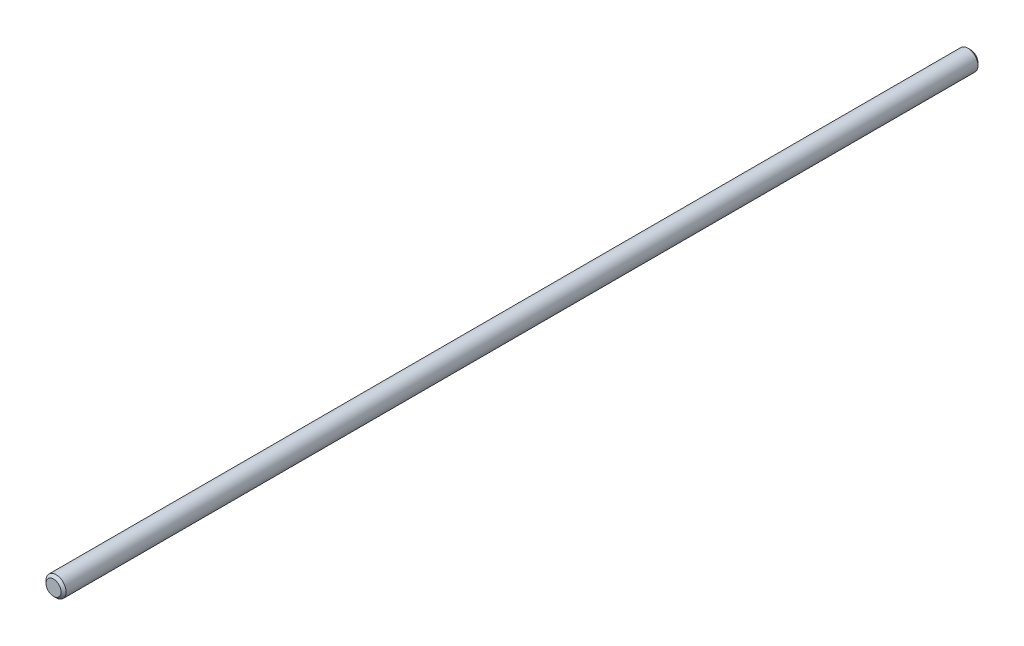
from build123d import *

# Parameters (mm, degrees)
SCHIZZO1_R                   = 4
ESTRUSIONE_ESTRUSIONE1_DEPTH = 365
SMUSSO1_SIZE                 = 1


with BuildPart() as part:
    # Schizzo1 → Estrusione-Estrusione1 (new body)
    with BuildSketch(Plane.XY):
        with Locations(Location((0, 0, 0), (0, 0, 180))):
            Circle(SCHIZZO1_R)
    extrude(amount=ESTRUSIONE_ESTRUSIONE1_DEPTH)

    # Smusso1
    smusso1_edges = [part.edges().sort_by_distance(p)[0] for p in [
        (4, 0, 0),
        (4, 0, 365),
    ]]
    chamfer(smusso1_edges, length=SMUSSO1_SIZE)


solid = part.part
